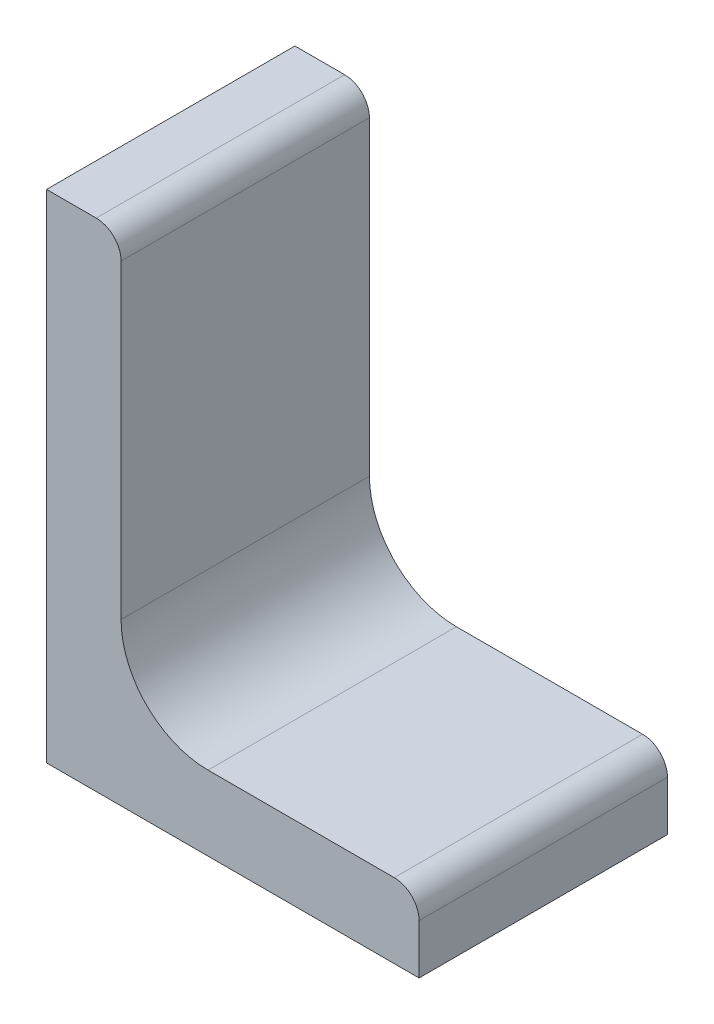
from build123d import *

# Parameters (mm, degrees)
EXTRUDE_1_DEPTH = 10
FILLET_1_R      = 1
FILLET_2_R      = 3.5


with BuildPart() as part:
    # 草图1 → 凸台-拉伸1 (new body)
    with BuildSketch(Plane(origin=(0, 0, 0), x_dir=(-1, 0, 0), z_dir=(0, 0, -1))):
        Polygon((0, 20), (0, 0), (-15, 0), (-15, 3), (-3, 3), (-3, 20), align=None)
    extrude(amount=-EXTRUDE_1_DEPTH)

    # 圆角1
    fillet_1_edges = [part.edges().sort_by_distance(p)[0] for p in [
        (15, 3, 5),
        (3, 20, 5),
    ]]
    fillet(fillet_1_edges, radius=FILLET_1_R)

    # 圆角2
    fillet_2_edges = [part.edges().sort_by_distance(p)[0] for p in [
        (3, 3, 5),
    ]]
    fillet(fillet_2_edges, radius=FILLET_2_R)


solid = part.part
